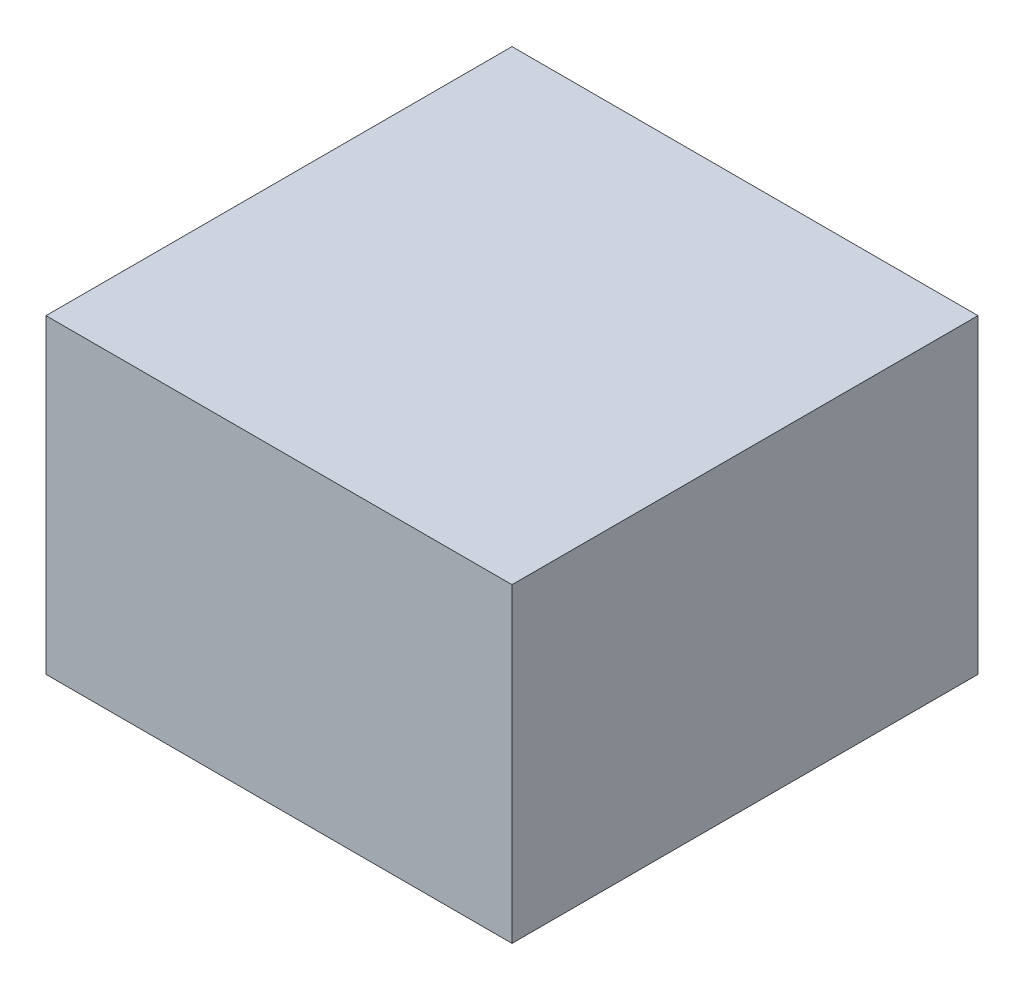
from build123d import *

# Parameters (mm, degrees)
ESQUISSE1_W         = 30
ESQUISSE1_H         = 20
BOSS_EXTRU_1_DEPTH  = 30
SKETCH1_R           = 5
BOSS_EXTRUDE1_DEPTH = 10


with BuildPart() as part:
    # Esquisse1 → Boss.-Extru.1 (new body)
    with BuildSketch(Plane.XY):
        with Locations((-15, 10)):
            Rectangle(ESQUISSE1_W, ESQUISSE1_H)
    extrude(amount=BOSS_EXTRU_1_DEPTH)

    # Sketch1 → Boss-Extrude1 (add)
    with BuildSketch(Plane(origin=(0, 0, 0), x_dir=(1, 0, 0), z_dir=(0, 1, 0))):
        with Locations(Location((-20, -10, 0), (0, 0, 270))):
            Circle(SKETCH1_R)
    extrude(amount=-BOSS_EXTRUDE1_DEPTH)


solid = part.part
